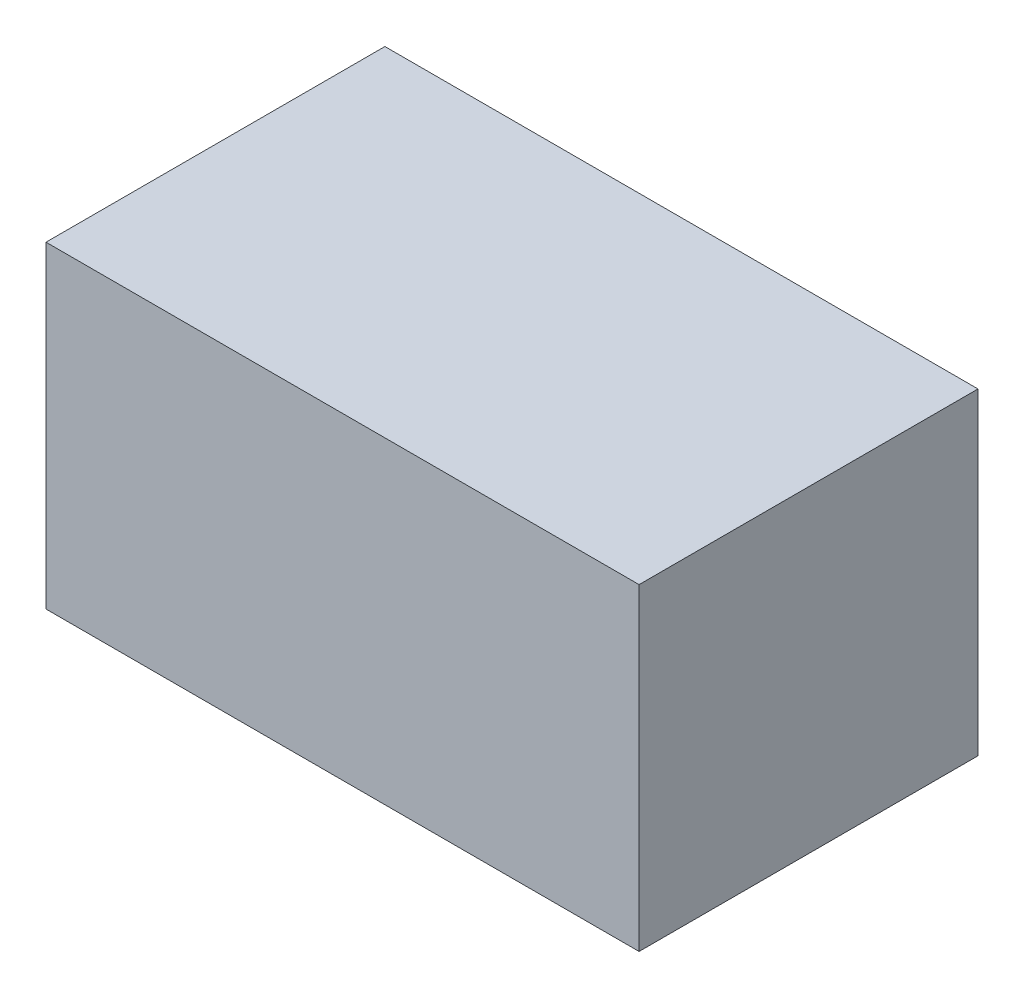
from build123d import *

# Parameters (mm, degrees)
SZKIC1_W                    = 140
SZKIC1_H                    = 80
DODANIE_WYCI_GNI_CIE1_DEPTH = 75


with BuildPart() as part:
    # Szkic1 → Dodanie-wyciągnięcie1 (new body)
    with BuildSketch(Plane(origin=(0, 0, 0), x_dir=(1, 0, 0), z_dir=(0, 1, 0))):
        Rectangle(SZKIC1_W, SZKIC1_H)
    extrude(amount=DODANIE_WYCI_GNI_CIE1_DEPTH)


solid = part.part
